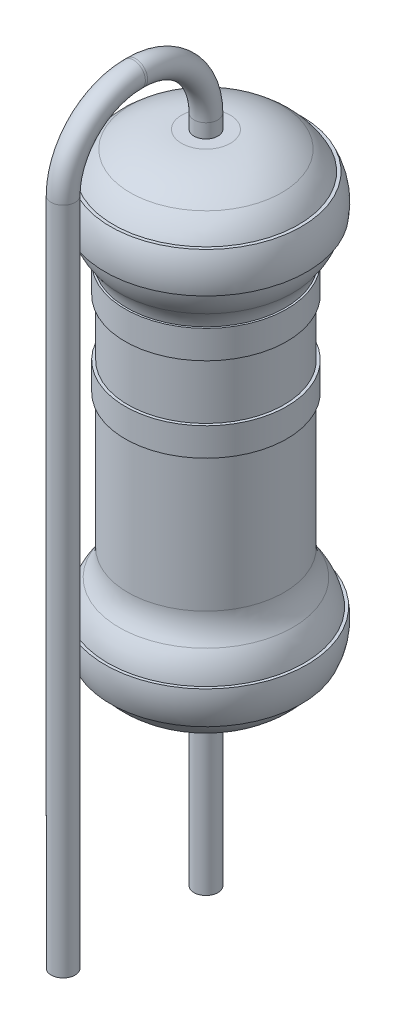
from build123d import *

# Parameters (mm, degrees)
SWEEP1_PROFILE_R = 0.425


with BuildPart() as part:
    # Sketch1 → Revolve1 (revolve)
    with BuildSketch(Plane(origin=(0, 0, 0), x_dir=(0, 0, -1), z_dir=(1, 0, 0)), mode=Mode.PRIVATE) as revolve1_sk:
        with BuildLine():
            Line((-2.775, -4.23083487), (-2.775, 0.55))
            Line((-2.775, 0.55), (-2.875, 0.55))
            Line((-2.875, 0.55), (-2.875, 1.55))
            Line((-2.875, 1.55), (-2.775, 1.55))
            Line((-2.775, 1.55), (-2.775, 3.55))
            Line((-2.775, 3.55), (-2.875, 3.55))
            Line((-2.875, 3.55), (-2.875, 4.55))
            Line((-2.875, 4.55), (-2.809348739, 4.55))
            ThreePointArc((-2.809348739, 4.55), (-2.915957278, 4.865659947), (-3.089615901, 5.15))
            ThreePointArc((-3.089615901, 5.15), (-3.34369004, 5.575690752), (-3.487901766, 6.05))
            Line((-3.487901766, 6.05), (-3.589356744, 6.05))
            ThreePointArc((-3.589356744, 6.05), (-3.595964536, 6.714955812), (-3.398660777, 7.35))
            Line((-3.398660777, 7.35), (-3.28656899, 7.35))
            ThreePointArc((-3.28656899, 7.35), (-3.030302783, 7.730047811), (-2.695848299, 8.043494625))
            ThreePointArc((-2.695848299, 8.043494625), (-1.830840994, 8.494415831), (-0.867845076, 8.65))
            Line((-0.867845076, 8.65), (0, 8.65))
            Line((0, 8.65), (0, -8.65))
            Line((0, -8.65), (-0.867845076, -8.65))
            ThreePointArc((-0.867845076, -8.65), (-1.830840994, -8.494415831), (-2.695848299, -8.043494625))
            ThreePointArc((-2.695848299, -8.043494625), (-3.030302783, -7.730047811), (-3.28656899, -7.35))
            Line((-3.28656899, -7.35), (-3.398660777, -7.35))
            ThreePointArc((-3.398660777, -7.35), (-3.595964536, -6.714955812), (-3.589356744, -6.05))
            Line((-3.589356744, -6.05), (-3.487901766, -6.05))
            ThreePointArc((-3.487901766, -6.05), (-3.34369004, -5.575690752), (-3.089615901, -5.15))
            ThreePointArc((-3.089615901, -5.15), (-2.855831908, -4.716593992), (-2.775, -4.23083487))
        make_face()
    revolve(revolve1_sk.sketch.rotate(Axis((0, -8.65, 0), (0, 1, 0)), 180), axis=Axis((0, -8.65, 0), (0, 1, 0)))

    # Sweep1: sweep along a path in Sketch2
    with BuildLine(Plane(origin=(0, 0, 0), x_dir=(0, 0, -1), z_dir=(1, 0, 0))) as sweep1_path:
        Line((-5.08, -14.65), (-5.08, 9.15))
        ThreePointArc((-5.08, 9.15), (-4.347766953, 10.917766953), (-2.58, 11.65))
        Line((-2.58, 11.65), (-2.5, 11.65))
        ThreePointArc((-2.5, 11.65), (-0.732233047, 10.917766953), (0, 9.15))
        Line((0, 9.15), (0, 0))
        Line((0, 0), (0, -14.65))
    # Sweep1 profile (on start of the path) → Sweep1 (sweep)
    with BuildSketch(Plane(origin=(0, -14.65, 5.08), x_dir=(0, 0, 1), z_dir=(0, 1, 0))):
        Circle(SWEEP1_PROFILE_R)
    sweep(path=sweep1_path.line)


solid = part.part
